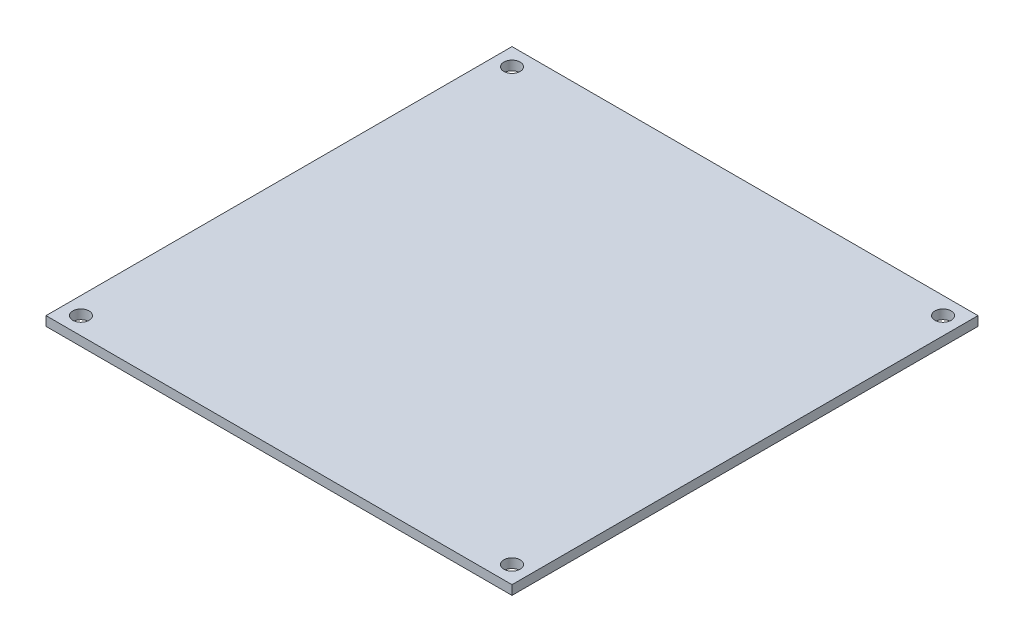
from build123d import *

# Parameters (mm, degrees)
SKETCH_2_W      = 100
SKETCH_2_H      = 100
SKETCH_2_R      = 1.75
EXTRUDE_1_DEPTH = 2


with BuildPart() as part:
    # 스케치2 → 보스-돌출1 (new body)
    with BuildSketch(Plane(origin=(0, 0, 0), x_dir=(1, 0, 0), z_dir=(0, 1, 0))):
        Rectangle(SKETCH_2_W, SKETCH_2_H)
        with Locations(Location((-46.25, 46.25, 0), (0, 0, 270))):
            Circle(SKETCH_2_R, mode=Mode.SUBTRACT)
        with Locations(Location((46.25, 46.25, 0), (0, 0, 90))):
            Circle(SKETCH_2_R, mode=Mode.SUBTRACT)
        with Locations(Location((46.25, -46.25, 0), (0, 0, 270))):
            Circle(SKETCH_2_R, mode=Mode.SUBTRACT)
        with Locations(Location((-46.25, -46.25, 0), (0, 0, 90))):
            Circle(SKETCH_2_R, mode=Mode.SUBTRACT)
    extrude(amount=EXTRUDE_1_DEPTH)


solid = part.part
